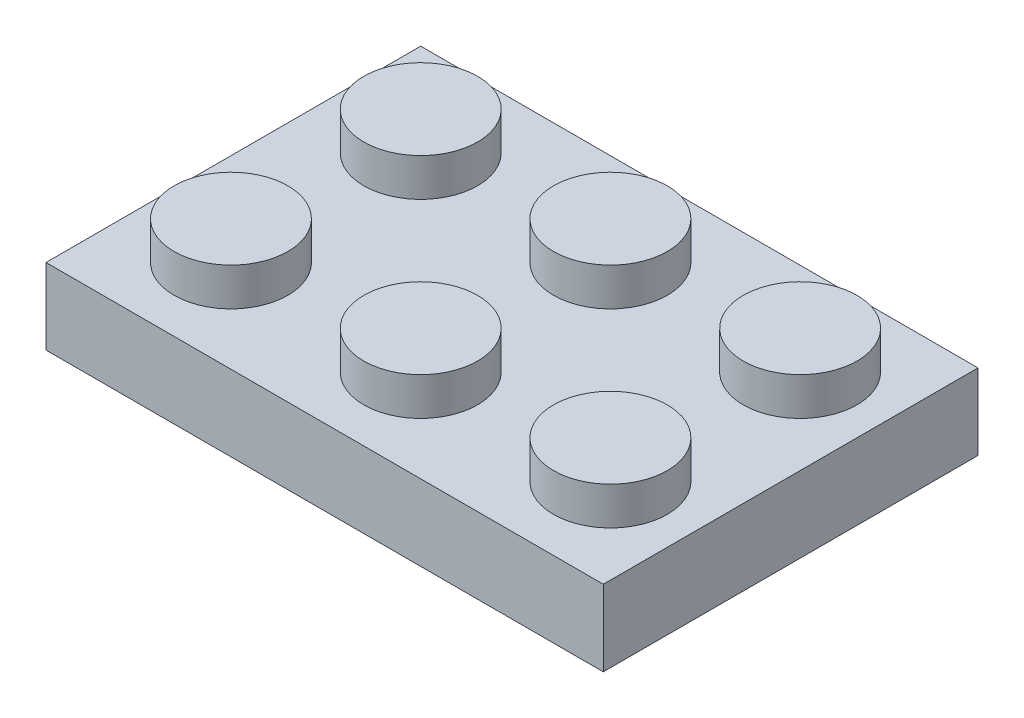
from build123d import *

# Parameters (mm, degrees)
SKETCH1_W            = 23.5
SKETCH1_H            = 3.2
BOSS_EXTRUDE1_DEPTH  = 15.8
SKETCH2_R            = 2.4
BOSS_EXTRUDE2_DEPTH  = 1.6
LPATTERN1_COUNT      = 2
LPATTERN1_PITCH      = 8
LPATTERN1_COUNT_DIR2 = 4
LPATTERN1_PITCH_DIR2 = 8
SHELL1_T             = -1.2
SKETCH4_R            = 3.25
SKETCH4_R_2          = 2.4
BOSS_EXTRUDE3_DEPTH  = 1.8
LPATTERN2_COUNT      = 2
LPATTERN2_PITCH      = 8


with BuildPart() as part:
    # Sketch1 → Boss-Extrude1 (new body)
    with BuildSketch(Plane.XY):
        with Locations((11.75, 1.6)):
            Rectangle(SKETCH1_W, SKETCH1_H)
    extrude(amount=-BOSS_EXTRUDE1_DEPTH)

    # Sketch2 → Boss-Extrude2 (add)
    with BuildSketch(Plane(origin=(0, 3.2, 0), x_dir=(1, 0, 0), z_dir=(0, 1, 0))):
        with Locations(Location((3.9, 3.9, 0), (0, 0, 270))):
            Circle(SKETCH2_R)
    boss_extrude2 = extrude(amount=BOSS_EXTRUDE2_DEPTH)

    # LPattern1: Boss-Extrude2 2 × 4, 2 skipped
    with Locations(*[(j * LPATTERN1_PITCH_DIR2, 0, -i * LPATTERN1_PITCH) for i in range(LPATTERN1_COUNT) for j in range(LPATTERN1_COUNT_DIR2) if (i, j) not in ((0, 0), (0, 3), (1, 3))]):
        add(boss_extrude2)

    # Shell1
    shell1_openings = [part.faces().sort_by_distance(p)[0] for p in [
        (11.75, 0, -7.9),
    ]]
    offset(amount=SHELL1_T, openings=shell1_openings, kind=Kind.INTERSECTION)

    # Sketch4 → Boss-Extrude3 (add)
    with BuildSketch(Plane.XZ.offset(-2)):
        with Locations(Location((7.9, -7.9, 0), (0, 0, 90))):
            Circle(SKETCH4_R)
        with Locations(Location((7.9, -7.9, 0), (0, 0, 270))):
            Circle(SKETCH4_R_2, mode=Mode.SUBTRACT)
    boss_extrude3 = extrude(amount=BOSS_EXTRUDE3_DEPTH)

    # LPattern2: Boss-Extrude3 ×2
    with Locations(*[(i * LPATTERN2_PITCH, 0, 0) for i in range(1, LPATTERN2_COUNT)]):
        add(boss_extrude3)


solid = part.part
